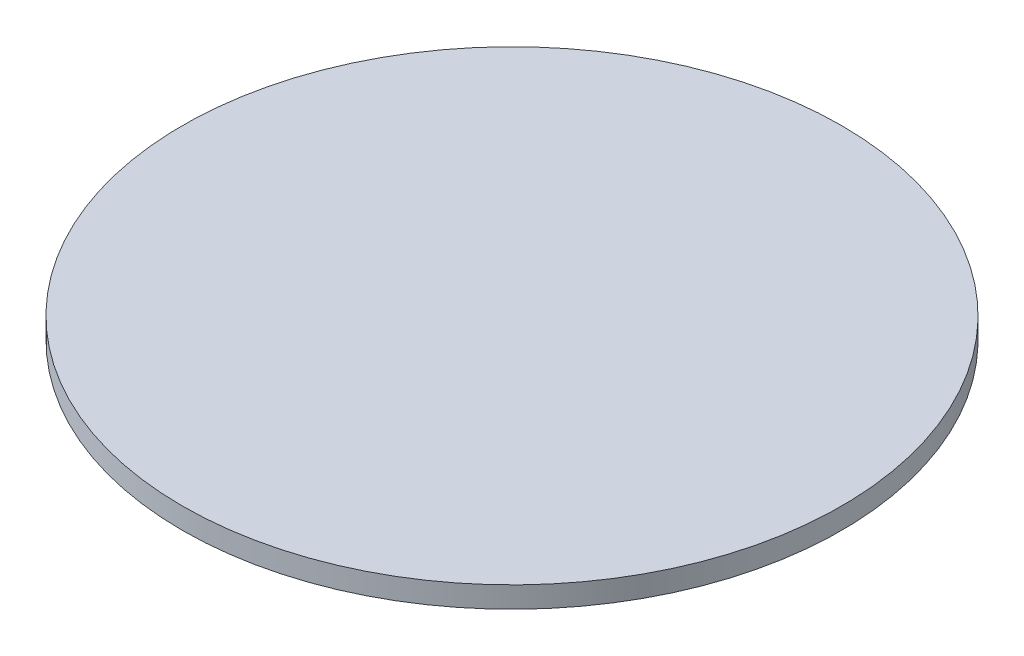
from build123d import *

# Parameters (mm, degrees)
SKETCH2_R           = 49.53
BOSS_EXTRUDE1_DEPTH = 3.175


with BuildPart() as part:
    # Sketch2 → Boss-Extrude1 (new body)
    with BuildSketch(Plane(origin=(0, 0, 0), x_dir=(1, 0, 0), z_dir=(0, 1, 0))):
        with Locations(Location((0, 0, 0), (0, 0, 270))):
            Circle(SKETCH2_R)
    extrude(amount=BOSS_EXTRUDE1_DEPTH)


solid = part.part
